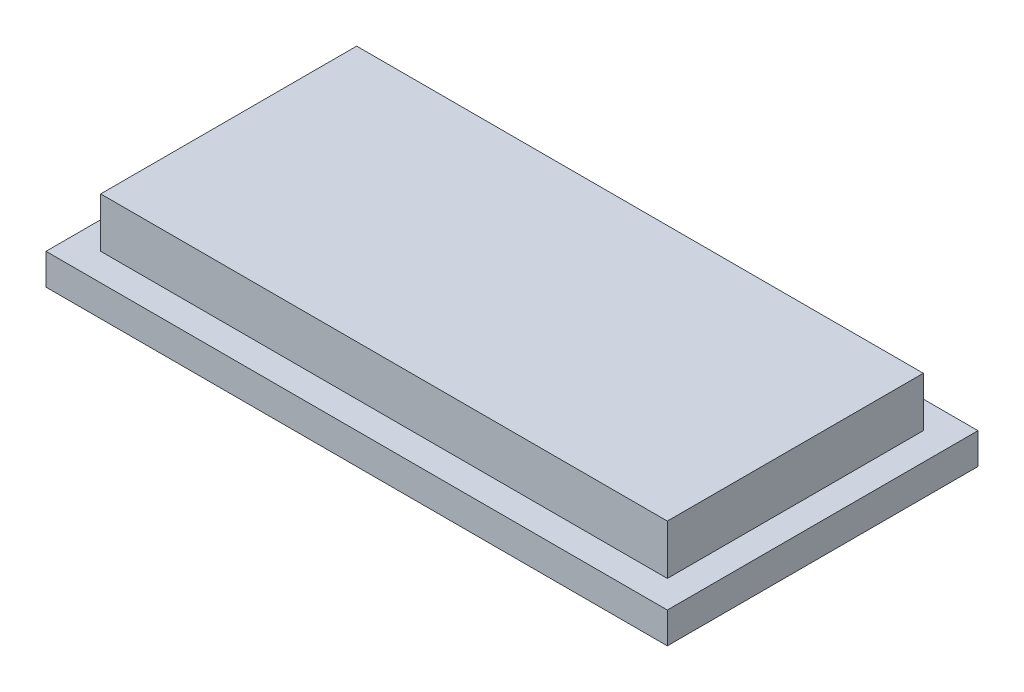
from build123d import *

# Parameters (mm, degrees)
SKETCH1_W           = 50
SKETCH1_H           = 25
BOSS_EXTRUDE1_DEPTH = 2.5
SKETCH2_W           = 45.6
SKETCH2_H           = 20.6
BOSS_EXTRUDE2_DEPTH = 4


with BuildPart() as part:
    # Sketch1 → Boss-Extrude1 (new body)
    with BuildSketch(Plane(origin=(0, 0, 0), x_dir=(1, 0, 0), z_dir=(0, 1, 0))):
        with Locations((25, 12.5)):
            Rectangle(SKETCH1_W, SKETCH1_H)
    extrude(amount=BOSS_EXTRUDE1_DEPTH)

    # Sketch2 → Boss-Extrude2 (add)
    with BuildSketch(Plane(origin=(0, 2.5, 0), x_dir=(1, 0, 0), z_dir=(0, 1, 0))):
        with Locations((25, 12.5)):
            Rectangle(SKETCH2_W, SKETCH2_H)
    extrude(amount=BOSS_EXTRUDE2_DEPTH)


solid = part.part
